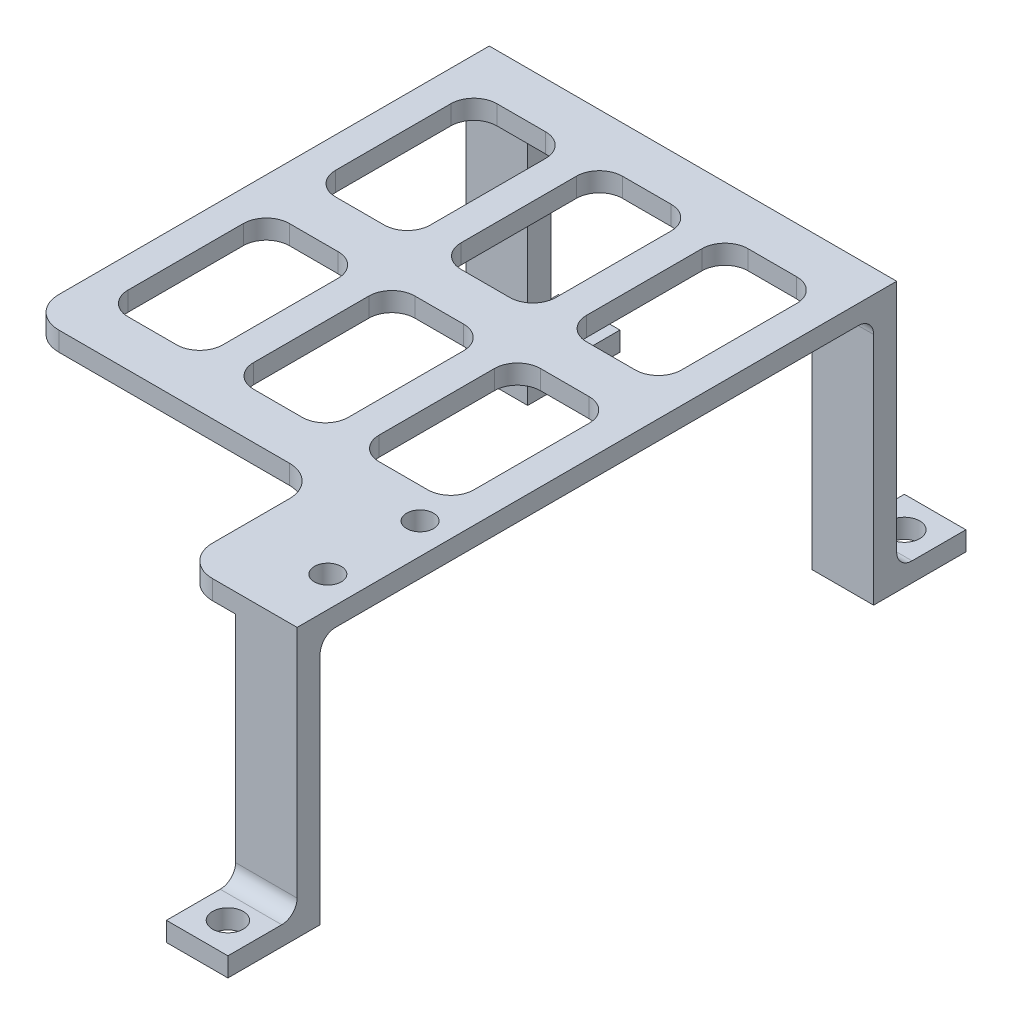
from build123d import *

# Parameters (mm, degrees)
SKETCH1_W             = 8
SKETCH1_H             = 12
SKETCH1_R             = 2
BOSS_EXTRUDE1_DEPTH   = 2.5
BOSS_EXTRUDE1_2_DEPTH = 2.5
BOSS_EXTRUDE1_3_DEPTH = 2.5
SKETCH2_W             = 8
SKETCH2_H             = 3
BOSS_EXTRUDE2_DEPTH   = 30
SKETCH3_R             = 1.75
SKETCH3_W             = 12.333333333
SKETCH3_H             = 21
SKETCH3_W_2           = 12.333333334
BOSS_EXTRUDE3_DEPTH   = 2.5
FILLET1_R             = 3
FILLET2_R             = 4
FILLET3_R             = 2
FILLET4_R             = 2


with BuildPart() as part:
    # Sketch1 → Boss-Extrude1 (new body)
    with BuildSketch(Plane(origin=(0, 0, 0), x_dir=(1, 0, 0), z_dir=(0, 1, 0))):
        with Locations((-41, 78)):
            Rectangle(SKETCH1_W, SKETCH1_H)
        with Locations(Location((-41, 80, 0), (0, 0, 270))):
            Circle(SKETCH1_R, mode=Mode.SUBTRACT)
    extrude(amount=BOSS_EXTRUDE1_DEPTH)



with BuildPart() as body_2:
    # Sketch1 → Boss-Extrude1 2 (new body)
    with BuildSketch(Plane(origin=(0, 0, 0), x_dir=(1, 0, 0), z_dir=(0, 1, 0))):
        with Locations((4, -6)):
            Rectangle(SKETCH1_W, SKETCH1_H)
        with Locations(Location((4, -8, 0), (0, 0, 270))):
            Circle(SKETCH1_R, mode=Mode.SUBTRACT)
    extrude(amount=BOSS_EXTRUDE1_2_DEPTH)


with BuildPart() as body_3:
    # Sketch1 → Boss-Extrude1 3 (new body)
    with BuildSketch(Plane(origin=(0, 0, 0), x_dir=(1, 0, 0), z_dir=(0, 1, 0))):
        with Locations((4, 78)):
            Rectangle(SKETCH1_W, SKETCH1_H)
        with Locations(Location((4, 80, 0), (0, 0, 270))):
            Circle(SKETCH1_R, mode=Mode.SUBTRACT)
    extrude(amount=BOSS_EXTRUDE1_3_DEPTH)


with BuildPart() as part_1:
    add(part.part)

    add(body_2.part)  # Boss-Extrude2 merges body 2

    add(body_3.part)  # Boss-Extrude2 merges body 3
    # Sketch2 → Boss-Extrude2 (add)
    with BuildSketch(Plane(origin=(0, 2.5, 0), x_dir=(1, 0, 0), z_dir=(0, 1, 0))):
        with Locations((-41, 73.5)):
            Rectangle(SKETCH2_W, SKETCH2_H)
        with Locations((4, 73.5)):
            Rectangle(SKETCH2_W, SKETCH2_H)
        with Locations((4, -1.5)):
            Rectangle(SKETCH2_W, SKETCH2_H)
    extrude(amount=BOSS_EXTRUDE2_DEPTH)

    # Sketch3 → Boss-Extrude3 (add)
    with BuildSketch(Plane(origin=(0, 32.5, 0), x_dir=(1, 0, 0), z_dir=(0, 1, 0))):
        Polygon((-45, 75), (8, 75), (8, -3), (-7, -3), (-7, 15), (-45, 15), align=None)
        with Locations(Location((4, 5, 0), (0, 0, 270))):
            Circle(SKETCH3_R, mode=Mode.SUBTRACT)
        with Locations(Location((4, 17, 0), (0, 0, 270))):
            Circle(SKETCH3_R, mode=Mode.SUBTRACT)
        with Locations((-34.833333334, 58.5)):
            Rectangle(SKETCH3_W, SKETCH3_H, mode=Mode.SUBTRACT)
        with Locations((-18.5, 58.5)):
            Rectangle(SKETCH3_W_2, SKETCH3_H, mode=Mode.SUBTRACT)
        with Locations((-2.166666667, 58.5)):
            Rectangle(SKETCH3_W, SKETCH3_H, mode=Mode.SUBTRACT)
        with Locations((-34.833333334, 31.5)):
            Rectangle(SKETCH3_W, SKETCH3_H, mode=Mode.SUBTRACT)
        with Locations((-18.5, 31.5)):
            Rectangle(SKETCH3_W_2, SKETCH3_H, mode=Mode.SUBTRACT)
        with Locations((-2.166666667, 31.5)):
            Rectangle(SKETCH3_W, SKETCH3_H, mode=Mode.SUBTRACT)
    extrude(amount=BOSS_EXTRUDE3_DEPTH)

    # Fillet1
    fillet1_edges = [part_1.edges().sort_by_distance(p)[0] for p in [
        (-24.666666667, 33.75, -48),
        (-12.333333333, 33.75, -48),
        (-12.333333333, 33.75, -69),
        (-24.666666667, 33.75, -69),
        (-41, 33.75, -48),
        (-28.666666667, 33.75, -48),
        (-28.666666667, 33.75, -69),
        (-41, 33.75, -69),
        (-8.333333333, 33.75, -48),
        (4, 33.75, -48),
        (4, 33.75, -69),
        (-8.333333333, 33.75, -69),
        (-41, 33.75, -21),
        (-28.666666667, 33.75, -21),
        (-28.666666667, 33.75, -42),
        (-41, 33.75, -42),
        (-24.666666667, 33.75, -21),
        (-12.333333333, 33.75, -21),
        (-12.333333333, 33.75, -42),
        (-24.666666667, 33.75, -42),
        (-8.333333333, 33.75, -21),
        (4, 33.75, -21),
        (4, 33.75, -42),
        (-8.333333333, 33.75, -42),
    ]]
    fillet(fillet1_edges, radius=FILLET1_R)

    # Fillet2
    fillet2_edges = [part_1.edges().sort_by_distance(p)[0] for p in [
        (-45, 33.75, -15),
        (-7, 33.75, -15),
        (-7, 33.75, 3),
    ]]
    fillet(fillet2_edges, radius=FILLET2_R)

    # Fillet3
    fillet3_edges = [part_1.edges().sort_by_distance(p)[0] for p in [
        (4, 2.5, 3),
        (4, 2.5, -75),
        (-41, 2.5, -75),
    ]]
    fillet(fillet3_edges, radius=FILLET3_R)

    # Fillet4
    fillet4_edges = [part_1.edges().sort_by_distance(p)[0] for p in [
        (4, 32.5, 0),
        (4, 32.5, -72),
        (-41, 32.5, -72),
    ]]
    fillet(fillet4_edges, radius=FILLET4_R)


solid = part_1.part
